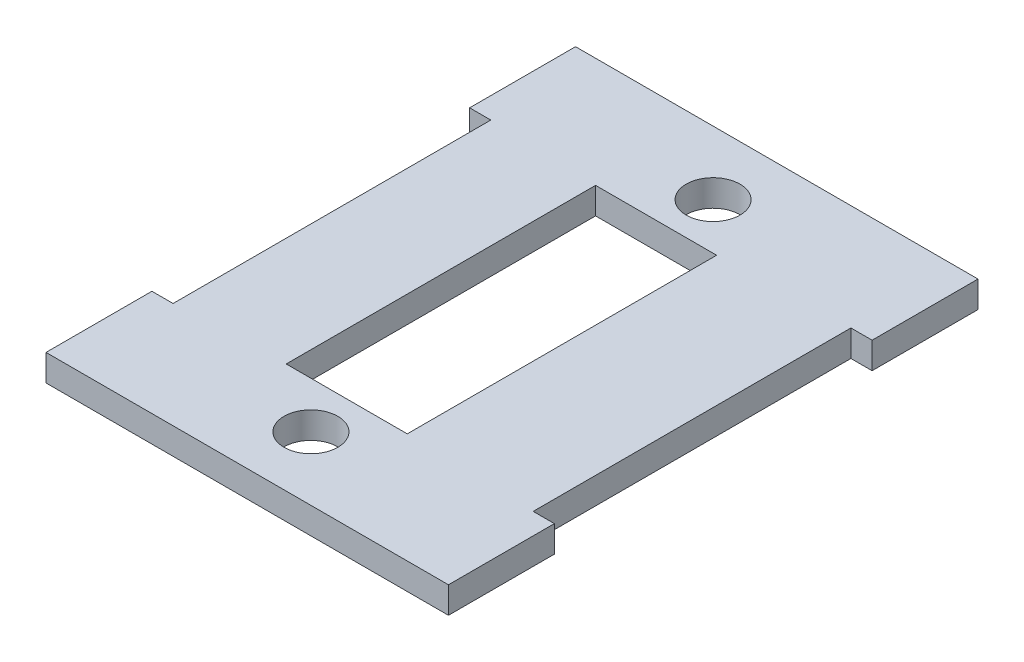
from build123d import *

# Parameters (mm, degrees)
SCHIZZO2_R                   = 2.54
SCHIZZO2_W                   = 11.43
SCHIZZO2_H                   = 29.21
ESTRUSIONE_ESTRUSIONE1_DEPTH = 1.25


with BuildPart() as part:
    # Schizzo2 → Estrusione-Estrusione1 (new, symmetric)
    with BuildSketch(Plane(origin=(0, 0, 0), x_dir=(1, 0, 0), z_dir=(0, 1, 0))):
        Polygon((-18, 15), (-16, 15), (-16, -15), (-18, -15), (-18, -25), (20, -25), (20, -15), (18, -15), (18, 15), (20, 15), (20, 25), (-18, 25), align=None)
        with Locations(Location((1, 18.985370086, 0), (0, 0, 270))):
            Circle(SCHIZZO2_R, mode=Mode.SUBTRACT)
        with Locations(Location((1, -18.985370086, 0), (0, 0, 270))):
            Circle(SCHIZZO2_R, mode=Mode.SUBTRACT)
        Rectangle(SCHIZZO2_W, SCHIZZO2_H, mode=Mode.SUBTRACT)
    extrude(amount=ESTRUSIONE_ESTRUSIONE1_DEPTH, both=True)


solid = part.part
